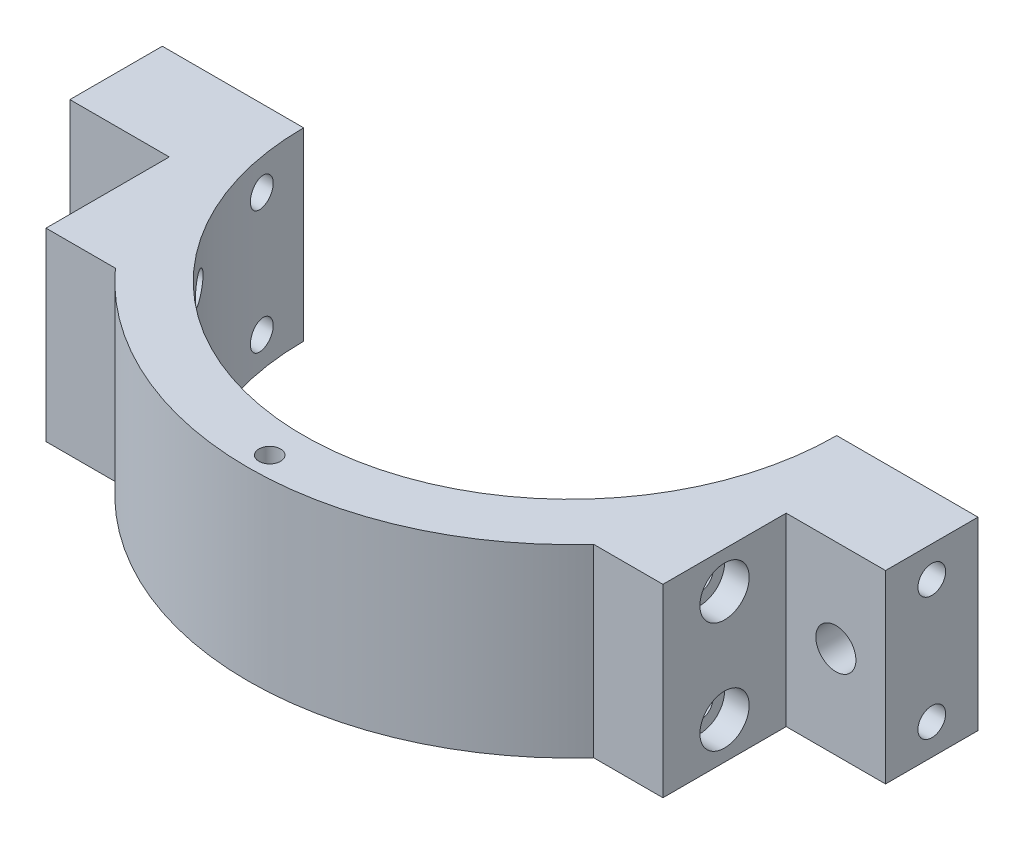
from build123d import *

# Parameters (mm, degrees)
BOSS_EXTRUDE1_DEPTH            = 15
SKETCH2_R                      = 3.25
CUT_EXTRUDE1_DEPTH             = 78.406027705
SKETCH3_R                      = 2.25
CUT_EXTRUDE2_DEPTH             = 144.078946739
CUT_EXTRUDE3_DEPTH             = 90.494095583
CUT_EXTRUDE3_DEPTH_BACK        = 90.494095583
SKETCH4_R                      = 1.75
BOSS_EXTRUDE2_DEPTH            = 30
CBORE_FOR_M4_SHCS1_D           = 4.3
CBORE_FOR_M4_SHCS1_DEPTH       = 100.101198794
CBORE_FOR_M4_SHCS1_CBORE_D     = 8
CBORE_FOR_M4_SHCS1_CBORE_DEPTH = 4
CBORE_FOR_M4_SHCS1_TIP         = 1.291850331


with BuildPart() as part:
    # Sketch1 → Boss-Extrude1 (new, symmetric)
    with BuildSketch(Plane(origin=(0, 0, 0), x_dir=(1, 0, 0), z_dir=(0, 1, 0))):
        with BuildLine():
            Line((-43.25, 0), (-66.175, 0))
            Line((-66.175, 0), (-66.175, -15))
            Line((-66.175, -15), (-50.050599397, -15))
            ThreePointArc((-50.050599397, -15), (0, -52.25), (50.050599397, -15))
            Line((50.050599397, -15), (66.175, -15))
            Line((66.175, -15), (66.175, 0))
            Line((66.175, 0), (43.25, 0))
            ThreePointArc((43.25, 0), (0, -43.25), (-43.25, 0))
        make_face()
    extrude(amount=BOSS_EXTRUDE1_DEPTH, both=True)

    # Sketch2 → Cut-Extrude1 (cut, through all)
    with BuildSketch(Plane.XY.offset(15)):
        with Locations((-58.112799699, 0)):
            Circle(SKETCH2_R)
        with Locations((58.112799699, 0)):
            Circle(SKETCH2_R)
    extrude(amount=-CUT_EXTRUDE1_DEPTH, mode=Mode.SUBTRACT)

    # Sketch3 → Cut-Extrude2 (cut, through all)
    with BuildSketch(Plane.ZY.offset(66.175)):
        with Locations((7.5, -10)):
            Circle(SKETCH3_R)
        with Locations((7.5, 10)):
            Circle(SKETCH3_R)
    extrude(amount=-CUT_EXTRUDE2_DEPTH, mode=Mode.SUBTRACT)

    # Sketch4 → Cut-Extrude3 (cut, two sides: drawn at the far end of the back side and taken through both)
    with BuildSketch(Plane(origin=(0, 15, 0), x_dir=(1, 0, 0), z_dir=(0, 1, 0)).offset(-CUT_EXTRUDE3_DEPTH_BACK)):
        with Locations(Location((0, -48.75, 0), (0, 0, 270))):
            Circle(SKETCH4_R)
    extrude(amount=CUT_EXTRUDE3_DEPTH + CUT_EXTRUDE3_DEPTH_BACK, mode=Mode.SUBTRACT)

    # Sketch5 → Boss-Extrude2 (add)
    with BuildSketch(Plane(origin=(0, 15, 0), x_dir=(1, 0, 0), z_dir=(0, 1, 0))):
        with BuildLine():
            Line((-50.050599397, -15), (-50.050599397, -35))
            Line((-50.050599397, -35), (-38.795135004, -35))
            ThreePointArc((-38.795135004, -35), (-45.534504832, -25.625599889), (-50.050599397, -15))
        make_face()
    boss_extrude2 = extrude(amount=-BOSS_EXTRUDE2_DEPTH)

    # Mirror1: Boss-Extrude2 across plane
    add(boss_extrude2.mirror(Plane.ZY))

    # CBORE for M4 SHCS1
    with Locations(Plane(origin=(50.050599397, 54.222001278, 632.558854999), x_dir=(0, -0.9379679207103062, -0.3467220496570483), z_dir=(1, 0, 0))):
        with Locations((253.070838002, 554.191250959), (269.954260575, 547.950254066)):
            CounterBoreHole(CBORE_FOR_M4_SHCS1_D / 2, CBORE_FOR_M4_SHCS1_CBORE_D / 2, CBORE_FOR_M4_SHCS1_CBORE_DEPTH, depth=CBORE_FOR_M4_SHCS1_DEPTH)
            with Locations((0, 0, -(CBORE_FOR_M4_SHCS1_DEPTH + CBORE_FOR_M4_SHCS1_TIP / 2))):  # 118° drill point
                Cone(0, CBORE_FOR_M4_SHCS1_D / 2, CBORE_FOR_M4_SHCS1_TIP, mode=Mode.SUBTRACT)


solid = part.part
